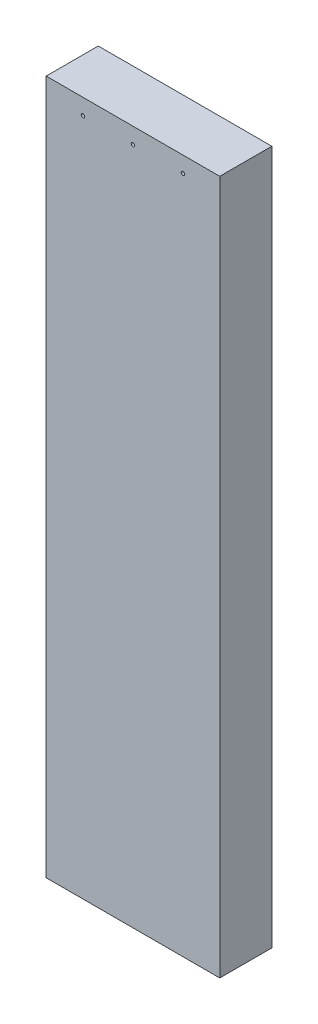
from build123d import *

# Parameters (mm, degrees)
SKETCH1_W           = 63.5
SKETCH1_H           = 19.05
BOSS_EXTRUDE1_DEPTH = 254
SKETCH2_R           = 0.635
CUT_EXTRUDE1_DEPTH  = 263.509337929


with BuildPart() as part:
    # Sketch1 → Boss-Extrude1 (new body)
    with BuildSketch(Plane(origin=(0, 0, 0), x_dir=(1, 0, 0), z_dir=(0, 1, 0))):
        with Locations((31.75, 9.525)):
            Rectangle(SKETCH1_W, SKETCH1_H)
    extrude(amount=BOSS_EXTRUDE1_DEPTH)

    # Sketch2 → Cut-Extrude1 (cut, through all)
    with BuildSketch(Plane.XY):
        with Locations((13.462, 248.158)):
            Circle(SKETCH2_R)
        with Locations((31.75, 248.158)):
            Circle(SKETCH2_R)
        with Locations((50.038, 248.158)):
            Circle(SKETCH2_R)
    extrude(amount=-CUT_EXTRUDE1_DEPTH, mode=Mode.SUBTRACT)


solid = part.part
